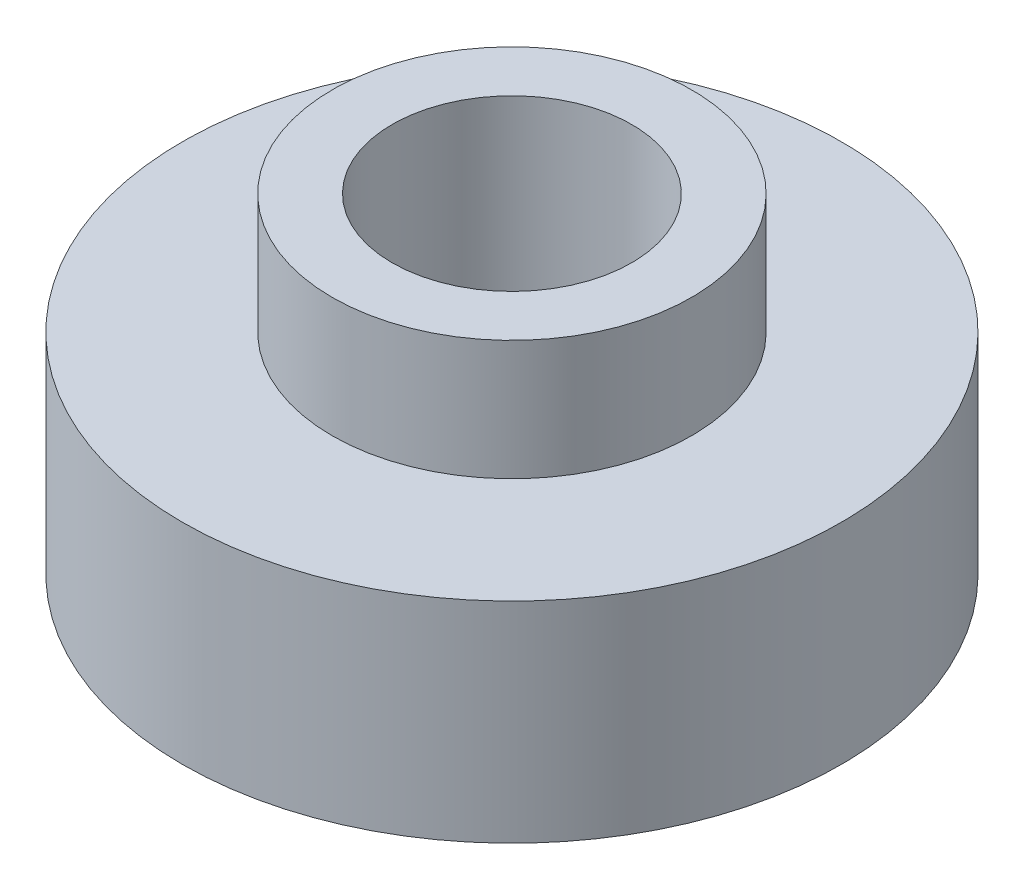
from build123d import *

# Parameters (mm, degrees)
SKETCH1_R           = 11
BOSS_EXTRUDE1_DEPTH = 7
SKETCH2_R           = 6
BOSS_EXTRUDE3_DEPTH = 4
SKETCH4_R           = 4
CUT_EXTRUDE1_DEPTH  = 11


with BuildPart() as part:
    # Sketch1 → Boss-Extrude1 (new body)
    with BuildSketch(Plane(origin=(0, 0, 0), x_dir=(1, 0, 0), z_dir=(0, 1, 0))):
        with Locations(Location((0, 0, 0), (0, 0, 270))):
            Circle(SKETCH1_R)
    extrude(amount=BOSS_EXTRUDE1_DEPTH)

    # Sketch2 → Boss-Extrude3 (add)
    with BuildSketch(Plane(origin=(0, 7, 0), x_dir=(1, 0, 0), z_dir=(0, 1, 0))):
        with Locations(Location((0, 0, 0), (0, 0, 270))):
            Circle(SKETCH2_R)
    extrude(amount=BOSS_EXTRUDE3_DEPTH)

    # Sketch4 → Cut-Extrude1 (cut)
    with BuildSketch(Plane(origin=(0, 11, 0), x_dir=(1, 0, 0), z_dir=(0, 1, 0))):
        with Locations(Location((0, 0, 0), (0, 0, 270))):
            Circle(SKETCH4_R)
    extrude(amount=-CUT_EXTRUDE1_DEPTH, mode=Mode.SUBTRACT)


solid = part.part
